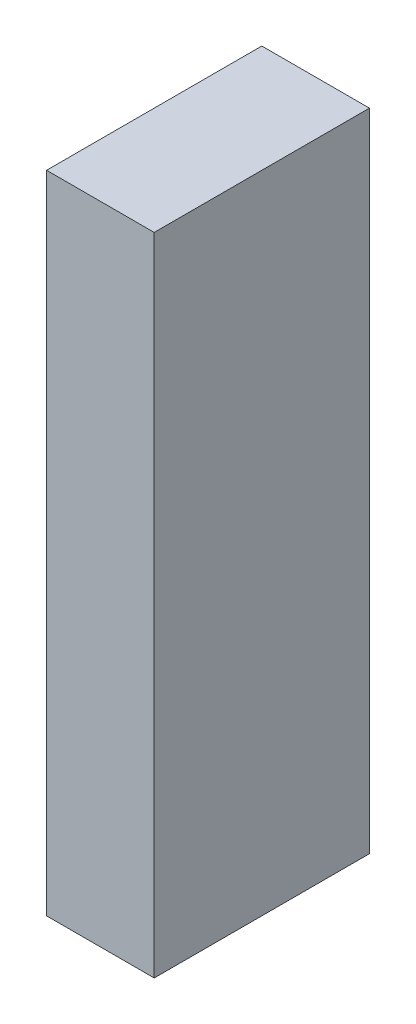
from build123d import *

# Parameters (mm, degrees)
SKETCH1_W           = 38.1
SKETCH1_H           = 114.3
BOSS_EXTRUDE1_DEPTH = 19.05


with BuildPart() as part:
    # Sketch1 → Boss-Extrude1 (new body)
    with BuildSketch(Plane(origin=(0, 0, 0), x_dir=(0, 0, -1), z_dir=(1, 0, 0))):
        Rectangle(SKETCH1_W, SKETCH1_H)
    extrude(amount=BOSS_EXTRUDE1_DEPTH)


solid = part.part
